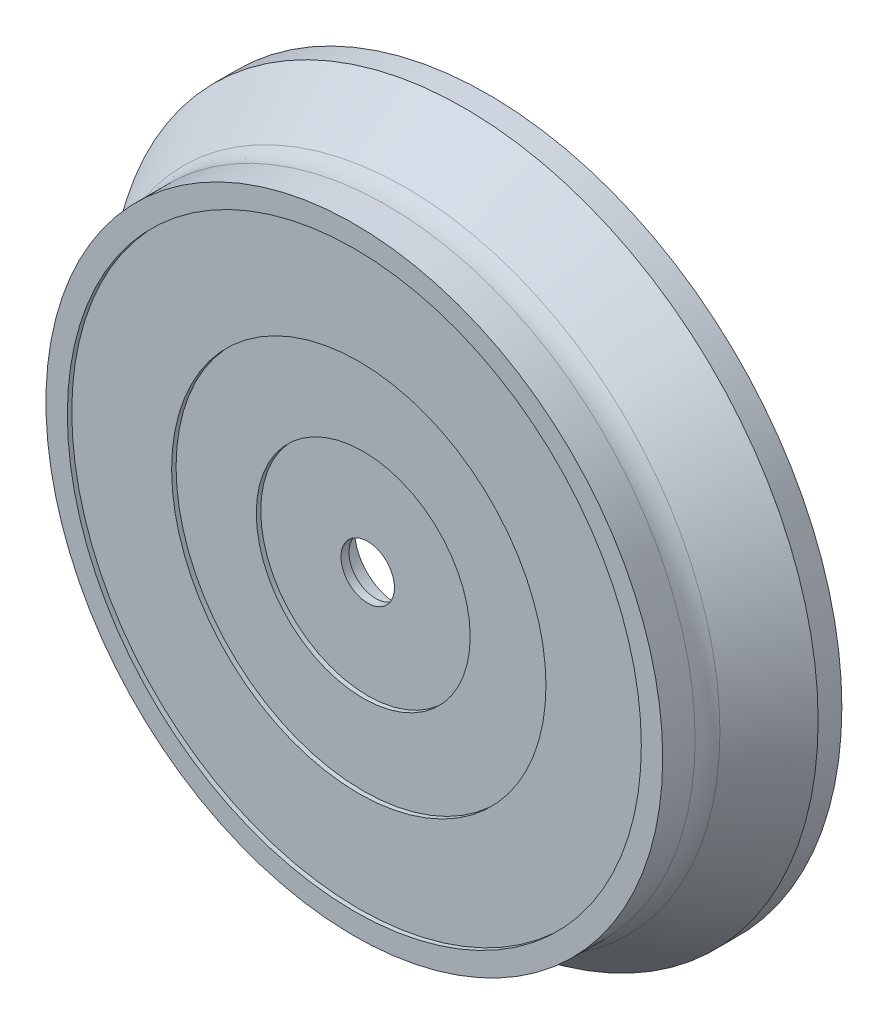
from build123d import *


with BuildPart() as part:
    # Sketch1 → Revolve1 (revolve)
    with BuildSketch(Plane.YZ, mode=Mode.PRIVATE) as revolve1_sk:
        with BuildLine():
            Line((-107.334, 0), (-115.334, 0))
            Line((-115.334, 0), (-115.334, -12.1078633))
            ThreePointArc((-115.334, -12.1078633), (-115.891433721, -15.829164705), (-117.514800653, -19.22379227))
            Line((-117.514800653, -19.22379227), (-132.334, -41.130434783))
            Line((-132.334, -41.130434783), (-132.334, -50))
            Line((-132.334, -50), (-130.334, -50))
            Line((-130.334, -50), (-107.334, -16))
            Line((-107.334, -16), (-15.875, -16))
            Line((-15.875, -16), (-15.875, -8))
            Line((-15.875, -8), (-10, -8))
            Line((-10, -8), (-10, -5))
            Line((-10, -5), (-40, -5))
            Line((-40, -5), (-40, -3.333333333))
            Line((-40, -3.333333333), (-70, -3.333333333))
            Line((-70, -3.333333333), (-70, -1.666666667))
            Line((-70, -1.666666667), (-107.334, -1.666666667))
            Line((-107.334, -1.666666667), (-107.334, 0))
        make_face()
    revolve(revolve1_sk.sketch.rotate(Axis((0, 0, 55), (0, 0, -1)), 270), axis=Axis((0, 0, 55), (0, 0, -1)))


solid = part.part
